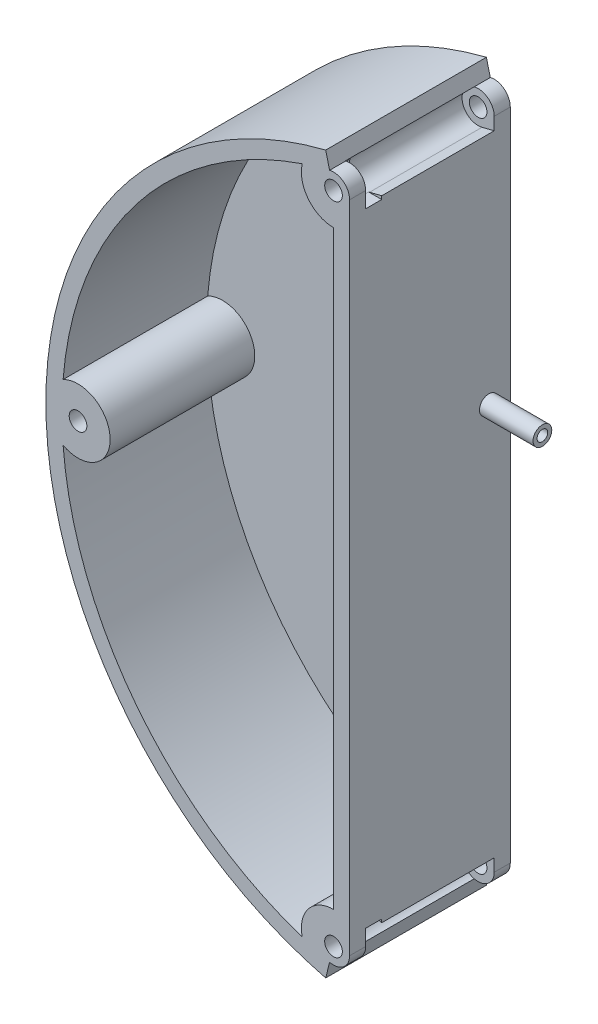
from build123d import *

# Parameters (mm, degrees)
SKETCH1_R           = 3
BOSS_EXTRUDE2_DEPTH = 30
SHELL1_T            = -3
SKETCH3_R           = 1.75
BOSS_EXTRUDE3_DEPTH = 10
SKETCH5_R           = 1.65
BOSS_EXTRUDE4_DEPTH = 3
CUT_EXTRUDE1_START  = -27
CUT_EXTRUDE1_DEPTH  = 27
CUT_EXTRUDE2_START  = -3
CUT_EXTRUDE2_DEPTH  = 3
BOSS_EXTRUDE5_START = -3
SKETCH8_R           = 1.65
BOSS_EXTRUDE5_DEPTH = 3
SKETCH9_R           = 1
CUT_EXTRUDE3_DEPTH  = 30


with BuildPart() as part:
    # Sketch1 → Boss-Extrude2 (new body)
    with BuildSketch(Plane.XY):
        with BuildLine():
            Line((-12.3, -61.113910037), (-12.3, 61.113910037))
            ThreePointArc((-12.3, 61.113910037), (-17.145844754, 58.748987809), (-16.028571429, 64.024096229))
            Line((-16.028571429, 64.024096229), (-16.757142857, 66.934282421))
            ThreePointArc((-16.757142857, 66.934282421), (-69, 0), (-16.757142857, -66.934282421))
            Line((-16.757142857, -66.934282421), (-16.028571429, -64.024096229))
            ThreePointArc((-16.028571429, -64.024096229), (-17.145844754, -58.748987809), (-12.3, -61.113910037))
        make_face()
        with Locations((-63, 0)):
            Circle(SKETCH1_R, mode=Mode.SUBTRACT)
    extrude(amount=BOSS_EXTRUDE2_DEPTH)

    # Shell1
    shell1_openings = [part.faces().sort_by_distance(p)[0] for p in [
        (-36.229379507, 0, 30),
    ]]
    offset(amount=SHELL1_T, openings=shell1_openings)

    # Sketch3 → Boss-Extrude3 (add)
    with BuildSketch(Plane.YZ.offset(-12.3)):
        with Locations(Location((15, 4, 0), (0, 0, 180))):
            Circle(SKETCH3_R)
    extrude(amount=BOSS_EXTRUDE3_DEPTH)

    # Sketch5 → Boss-Extrude4 (add)
    with BuildSketch(Plane.XY):
        with BuildLine():
            Line((-12.3, -61.113910037), (-12.3, 61.113910037))
            ThreePointArc((-12.3, 61.113910037), (-13.454155246, 63.478832265), (-16.028571429, 64.024096229))
            Line((-16.028571429, 64.024096229), (-16.757142857, 66.934282421))
            ThreePointArc((-16.757142857, 66.934282421), (-69, 0), (-16.757142857, -66.934282421))
            Line((-16.757142857, -66.934282421), (-16.028571429, -64.024096229))
            ThreePointArc((-16.028571429, -64.024096229), (-13.454155246, -63.478832265), (-12.3, -61.113910037))
        make_face()
        with Locations((-63, 0)):
            Circle(SKETCH5_R, mode=Mode.SUBTRACT)
        with Locations((-15.3, 61.113910037)):
            Circle(SKETCH5_R, mode=Mode.SUBTRACT)
        with Locations((-15.3, -61.113910037)):
            Circle(SKETCH5_R, mode=Mode.SUBTRACT)
    extrude(amount=BOSS_EXTRUDE4_DEPTH)

    # Sketch6 → Cut-Extrude1 (cut)
    with BuildSketch(Plane.XY.offset(30).offset(CUT_EXTRUDE1_START)):
        with BuildLine():
            Line((-63, 3), (-68.934751758, 3))
            ThreePointArc((-68.934751758, 3), (-71.934751758, 0), (-68.934751758, -3))
            Line((-68.934751758, -3), (-63, -3))
            ThreePointArc((-63, -3), (-60, 0), (-63, 3))
        make_face()
        with BuildLine():
            Line((-14.571428571, -58.203723845), (-12.3, -58.772380917))
            Line((-12.3, -58.772380917), (-12.3, -61.113910037))
            ThreePointArc((-12.3, -61.113910037), (-12.935077772, -59.268065283), (-14.571428571, -58.203723845))
        make_face()
        with BuildLine():
            Line((-14.571428571, 58.203723845), (-12.3, 58.772380917))
            Line((-12.3, 58.772380917), (-12.3, 61.113910037))
            ThreePointArc((-12.3, 61.113910037), (-12.935077772, 59.268065283), (-14.571428571, 58.203723845))
        make_face()
    extrude(amount=CUT_EXTRUDE1_DEPTH, mode=Mode.SUBTRACT)

    # Sketch7 → Cut-Extrude2 (cut)
    with BuildSketch(Plane.XY.offset(30).offset(CUT_EXTRUDE2_START)):
        Polygon((-13.596816706, -58.163910037), (-11.893633412, -58.163910037), (-11.893633412, -61.113910037), (-13.596816706, -64.063910037), (-17.003183294, -64.063910037), (-18.706366588, -61.113910037), (-17.003183294, -58.163910037), align=None)
        Polygon((-11.893633412, 61.113910037), (-13.596816706, 64.063910037), (-17.003183294, 64.063910037), (-18.706366588, 61.113910037), (-17.003183294, 58.163910037), (-13.596816706, 58.163910037), (-11.893633412, 58.163910037), align=None)
        Polygon((-59.593633412, 0), (-61.296816706, 2.95), (-64.703183294, 2.95), (-66.406366588, 0), (-64.703183294, -2.95), (-61.296816706, -2.95), align=None)
    extrude(amount=-CUT_EXTRUDE2_DEPTH, mode=Mode.SUBTRACT)

    # Sketch8 → Boss-Extrude5 (add)
    # profile 1 of 3: a face of its own
    with BuildSketch(Plane.XY.offset(30).offset(BOSS_EXTRUDE5_START)):
        with BuildLine():
            Line((-63, 3), (-68.934751758, 3))
            Line((-68.934751758, 3), (-68.934751758, -3))
            Line((-68.934751758, -3), (-63, -3))
            ThreePointArc((-63, -3), (-60, 0), (-63, 3))
        make_face()
        with Locations((-63, 0)):
            Circle(SKETCH8_R, mode=Mode.SUBTRACT)
    # profile 2 of 3: a face of its own
    with BuildSketch(Plane.XY.offset(30).offset(BOSS_EXTRUDE5_START)):
        with BuildLine():
            Line((-12.3, -58.772380917), (-14.571428571, -58.203723845))
            ThreePointArc((-14.571428571, -58.203723845), (-17.664922228, -62.959754791), (-12.3, -61.113910037))
            Line((-12.3, -61.113910037), (-12.3, -58.772380917))
        make_face()
        with Locations((-15.3, -61.113910037)):
            Circle(SKETCH8_R, mode=Mode.SUBTRACT)
    # profile 3 of 3: a face of its own
    with BuildSketch(Plane.XY.offset(30).offset(BOSS_EXTRUDE5_START)):
        with BuildLine():
            Line((-12.3, 61.113910037), (-12.3, 58.772380917))
            Line((-12.3, 58.772380917), (-14.571428571, 58.203723845))
            ThreePointArc((-14.571428571, 58.203723845), (-17.664922228, 62.959754791), (-12.3, 61.113910037))
        make_face()
        with Locations((-15.3, 61.113910037)):
            Circle(SKETCH8_R, mode=Mode.SUBTRACT)
    extrude(amount=BOSS_EXTRUDE5_DEPTH)

    # Sketch9 → Cut-Extrude3 (cut)
    with BuildSketch(Plane.YZ.offset(-2.3)):
        with Locations((15, 4)):
            Circle(SKETCH9_R)
    extrude(amount=-CUT_EXTRUDE3_DEPTH, mode=Mode.SUBTRACT)


solid = part.part
